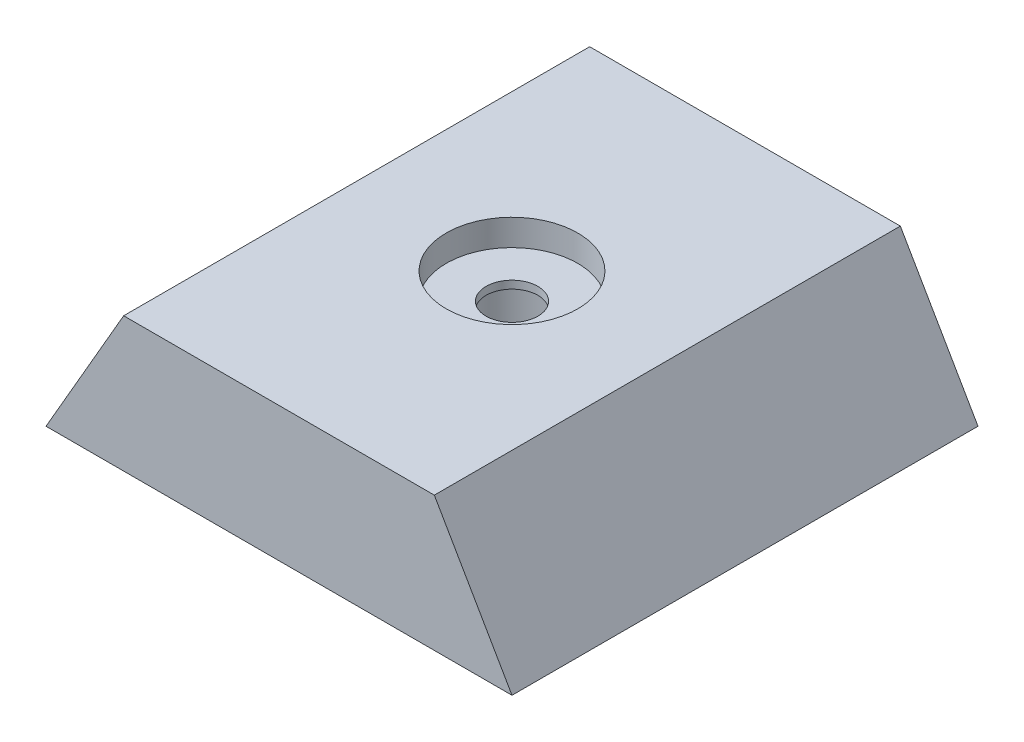
from build123d import *

# Parameters (mm, degrees)
BOSS_EXTRU_1_DEPTH      = 450
ESQUISSE3_R             = 63.5
ENL_V_MAT_EXTRU_1_DEPTH = 25.4
ESQUISSE4_R             = 25
ENL_V_MAT_EXTRU_2_DEPTH = 20
ESQUISSE2_R             = 50
ENL_V_MAT_EXTRU_3_DEPTH = 97
COQUE1_T                = -30


with BuildPart() as part:
    # Esquisse1 → Boss.-Extru.1 (new body)
    with BuildSketch(Plane.XY):
        Polygon((75, 129.903810568), (375, 129.903810568), (450, 0), (0, 0), align=None)
    extrude(amount=BOSS_EXTRU_1_DEPTH)

    # Esquisse3 → Enlèv. mat.-Extru.1 (cut)
    with BuildSketch(Plane(origin=(0, 129.903810568, 0), x_dir=(1, 0, 0), z_dir=(0, 1, 0))):
        with Locations(Location((225, -225, 0), (0, 0, 270))):
            Circle(ESQUISSE3_R)
    extrude(amount=-ENL_V_MAT_EXTRU_1_DEPTH, mode=Mode.SUBTRACT)

    # Esquisse4 → Enlèv. mat.-Extru.2 (cut)
    with BuildSketch(Plane(origin=(0, 104.503810568, 0), x_dir=(1, 0, 0), z_dir=(0, 1, 0))):
        with Locations(Location((225, -225, 0), (0, 0, 270))):
            Circle(ESQUISSE4_R)
    extrude(amount=-ENL_V_MAT_EXTRU_2_DEPTH, mode=Mode.SUBTRACT)

    # Esquisse2 → Enlèv. mat.-Extru.3 (cut)
    with BuildSketch(Plane.XZ):
        with Locations(Location((225, 225, 0), (0, 0, 270))):
            Circle(ESQUISSE2_R)
    extrude(amount=-ENL_V_MAT_EXTRU_3_DEPTH, mode=Mode.SUBTRACT)

    # Coque1
    coque1_openings = [part.faces().sort_by_distance(p)[0] for p in [
        (443.636038969, 0, 225),
    ]]
    offset(amount=COQUE1_T, openings=coque1_openings, kind=Kind.INTERSECTION)


solid = part.part
